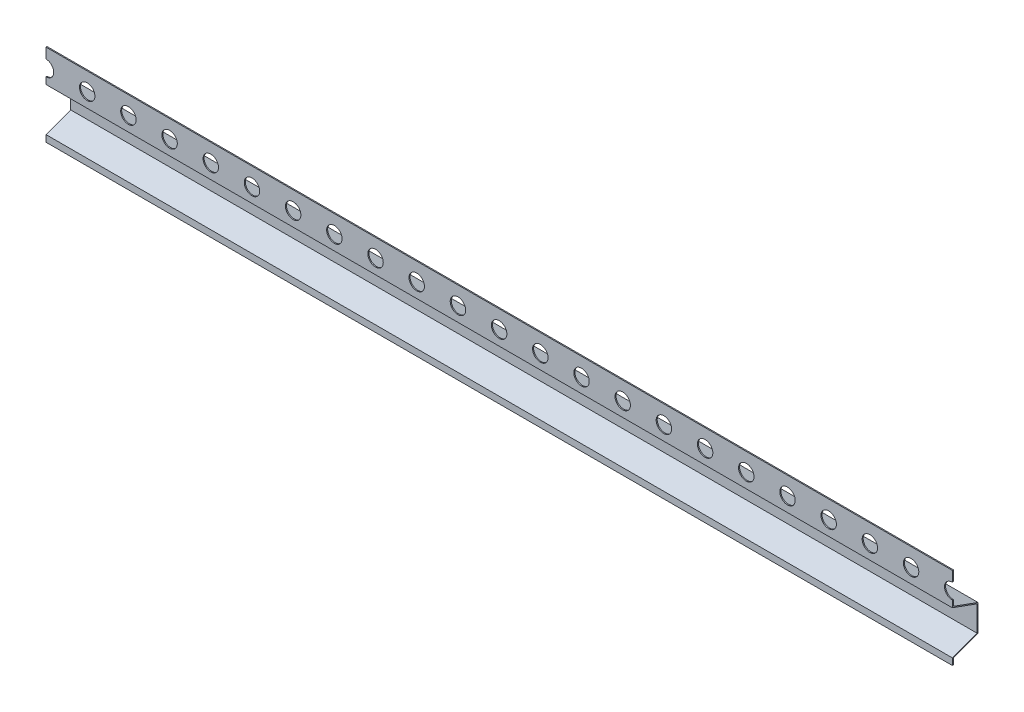
from build123d import *

# Parameters (mm, degrees)
TOP_SKETCH_W             = 88
TOP_SKETCH_H             = 8
THICKNESS_EXTRUDE_DEPTH  = 0.1
PIN_HOLE_SKETCH_R        = 0.75
FIRST_PIN_HOLE_CUT_DEPTH = 89.362944722
PIN_HOLE_PATTERN_COUNT   = 23
PIN_HOLE_PATTERN_PITCH   = 4
POCKET_CUT_OUT_DEPTH     = 89.362944722
POCKET_DEPTH             = 88


with BuildPart() as part:
    # Top Sketch → Thickness Extrude (new body)
    with BuildSketch(Plane.XY):
        with Locations((-44, -4)):
            Rectangle(TOP_SKETCH_W, TOP_SKETCH_H)
    extrude(amount=-THICKNESS_EXTRUDE_DEPTH)

    # Pin Hole Sketch → First Pin Hole Cut (cut, through all)
    with BuildSketch(Plane.XY):
        with Locations((0, -1.75)):
            Circle(PIN_HOLE_SKETCH_R)
    first_pin_hole_cut = extrude(amount=-FIRST_PIN_HOLE_CUT_DEPTH, mode=Mode.SUBTRACT)

    # Pin Hole Pattern: First Pin Hole Cut ×23
    with Locations(*[(-i * PIN_HOLE_PATTERN_PITCH, 0, 0) for i in range(1, PIN_HOLE_PATTERN_COUNT)]):
        add(first_pin_hole_cut, mode=Mode.SUBTRACT)

    # Pocket Cut Out Sketch → Pocket Cut Out (cut, through all)
    with BuildSketch(Plane(origin=(0, 0, 0), x_dir=(0, 0, -1), z_dir=(1, 0, 0))):
        Polygon((0, -3.145020754), (0, -7.354979246), (2.4, -6.481450684), (2.4, -4.018549316), align=None)
    extrude(amount=-POCKET_CUT_OUT_DEPTH, mode=Mode.SUBTRACT)


with BuildPart() as pocket_cut_out_piece_1:
    # of the separate pieces the step leaves, piece 1, a body of its own (pocket_cut_out_pieces)
    add(part.part.solids().sort_by_distance((-88, 0, 0))[0])



with BuildPart() as pocket_cut_out_piece_2:
    # of the separate pieces the step leaves, piece 2, a body of its own (pocket_cut_out_pieces)
    add(part.part.solids().sort_by_distance((0, -7.354979246, 0))[0])


with BuildPart() as pocket_cut_out_piece_1_1:
    add(pocket_cut_out_piece_1.part)

    add(pocket_cut_out_piece_2.part)  # Pocket merges Pocket Cut Out piece 2
    # Pocket Sketch → Pocket (add, through all)
    with BuildSketch(Plane(origin=(0, 0, 0), x_dir=(0, 0, -1), z_dir=(1, 0, 0))):
        Polygon((0, -3.145020754), (2.4, -4.018549316), (2.4, -6.481450684), (0, -7.354979246), (0.1, -7.425), (2.5, -6.551471438), (2.5, -3.948528562), (0.1, -3.075), align=None)
    extrude(amount=-POCKET_DEPTH)


solid = pocket_cut_out_piece_1_1.part
